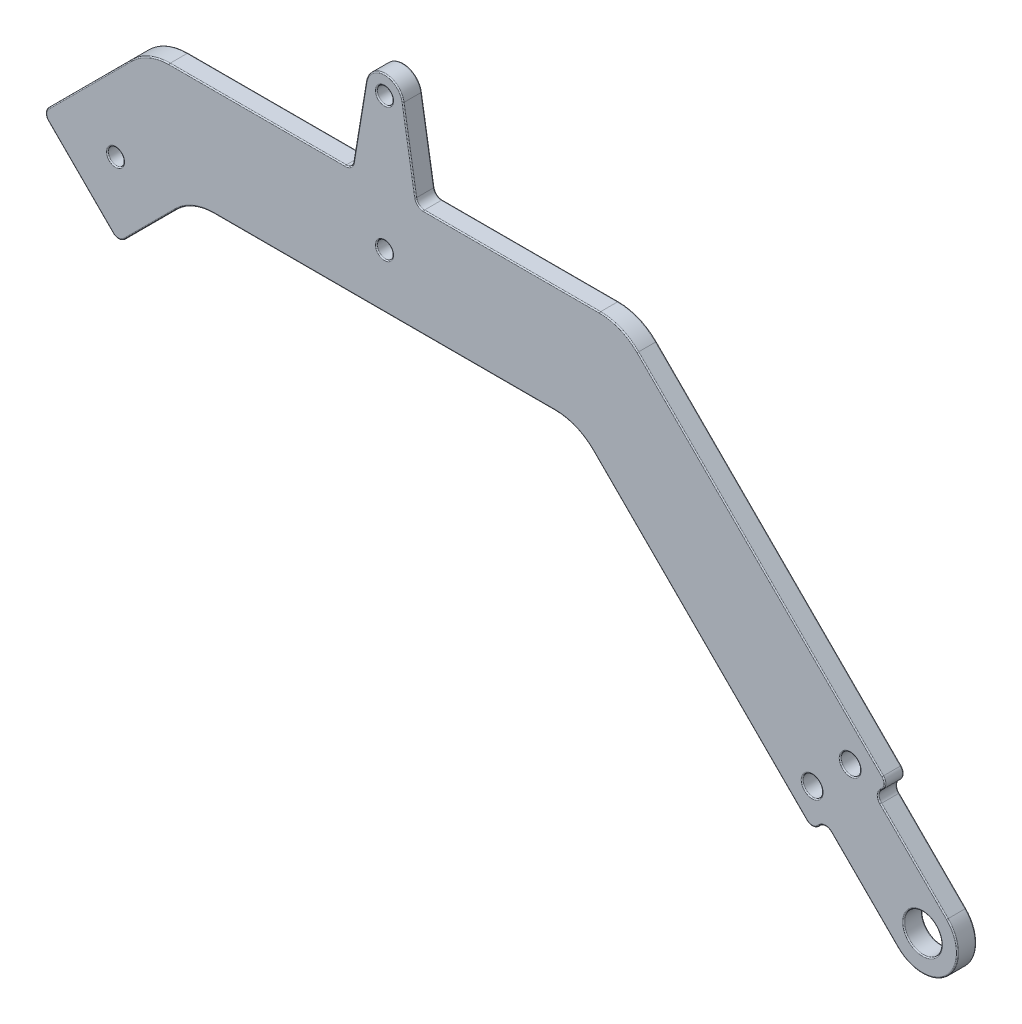
from build123d import *

# Parameters (mm, degrees)
SKETCH6_R           = 3.5
SKETCH6_R_2         = 1.842826212
SKETCH6_R_3         = 1.5
BOSS_EXTRUDE1_DEPTH = 3.5
FILLET1_R           = 10
FILLET2_R           = 1.5
FILLET3_R           = 0.2


with BuildPart() as part:
    # Sketch6 → Boss-Extrude1 (new body)
    # profile 1 of 3: a face of its own
    with BuildSketch(Plane.XY):
        with BuildLine():
            Line((91.161165235, 18.03122292), (81.96877708, 8.838834765))
            Line((81.96877708, 8.838834765), (95.403805922, -4.596194078))
            ThreePointArc((95.403805922, -4.596194078), (104.596194078, -4.596194078), (104.596194078, 4.596194078))
            Line((104.596194078, 4.596194078), (91.161165235, 18.03122292))
        make_face()
        with Locations((100, 0)):
            Circle(SKETCH6_R, mode=Mode.SUBTRACT)
    # profile 2 of 3: a face of its own
    with BuildSketch(Plane.XY):
        Polygon((79.493903346, 6.363961031), (81.96877708, 8.838834765), (91.161165235, 18.03122292), (93.636038969, 20.506096654), (44.142135624, 70), (6, 70), (-6, 70), (-44.142135624, 70), (-63.587572106, 50.554563517), (-49.445436483, 36.412427894), (-35.857864376, 50), (35.857864376, 50), align=None)
        with Locations((79.493903346, 13.435028843)):
            Circle(SKETCH6_R_2, mode=Mode.SUBTRACT)
        with Locations((86.564971157, 20.506096654)):
            Circle(SKETCH6_R_2, mode=Mode.SUBTRACT)
        with Locations((-50, 50)):
            Circle(SKETCH6_R_3, mode=Mode.SUBTRACT)
        with Locations((0, 60)):
            Circle(SKETCH6_R_3, mode=Mode.SUBTRACT)
    # profile 3 of 3: a face of its own
    with BuildSketch(Plane.XY):
        with BuildLine():
            Line((-6, 70), (6, 70))
            Line((6, 70), (3.453220204, 85.420324662))
            ThreePointArc((3.453220204, 85.420324662), (0, 88.35), (-3.453220204, 85.420324662))
            Line((-3.453220204, 85.420324662), (-6, 70))
        make_face()
        with Locations((0, 84.85)):
            Circle(SKETCH6_R_3, mode=Mode.SUBTRACT)
    extrude(amount=BOSS_EXTRUDE1_DEPTH)

    # Fillet1
    fillet1_edges = [part.edges().sort_by_distance(p)[0] for p in [
        (44.142135624, 70, 1.75),
        (35.857864376, 50, 1.75),
        (-35.857864376, 50, 1.75),
        (-44.142135624, 70, 1.75),
    ]]
    fillet(fillet1_edges, radius=FILLET1_R)

    # Fillet2
    fillet2_edges = [part.edges().sort_by_distance(p)[0] for p in [
        (6, 70, 1.75),
        (93.636038969, 20.506096654, 1.75),
        (91.161165235, 18.03122292, 1.75),
        (81.96877708, 8.838834765, 1.75),
        (79.493903346, 6.363961031, 1.75),
        (-49.445436483, 36.412427894, 1.75),
        (-63.587572106, 50.554563517, 1.75),
        (-6, 70, 1.75),
    ]]
    fillet(fillet2_edges, radius=FILLET2_R)

    # Fillet3
    fillet3_edges = [part.edges().sort_by_distance(p)[0] for p in [
        (-56.516504294, 43.483495706, 0),
        (93.014718626, 20.506096654, 0),
        (79.493903346, 6.985281374, 0),
        (-62.966251763, 50.554563517, 0),
        (-49.445436483, 37.033748237, 0),
        (-56.516504294, 43.483495706, 3.5),
        (-23.636292033, 70, 3.5),
        (80.731340213, 7.601397898, 3.5),
        (89.216621587, 1.590990258, 3.5),
        (98.409009742, 10.783378413, 3.5),
        (92.398602102, 19.268659787, 3.5),
        (69.823223305, 44.318912319, 3.5),
        (4.622926377, 78.337949903, 3.5),
        (-4.622926377, 78.337949903, 3.5),
        (93.014718626, 20.506096654, 3.5),
        (79.493903346, 6.985281374, 3.5),
        (-62.966251763, 50.554563517, 3.5),
        (-49.445436483, 37.033748237, 3.5),
        (-6.302181387, 70.356182427, 0),
        (96.5, 0, 3.5),
        (-6.302181387, 70.356182427, 3.5),
        (6.302181387, 70.356182427, 0),
        (6.302181387, 70.356182427, 3.5),
        (81.96877708, 8.217514421, 0),
        (81.96877708, 8.217514421, 3.5),
        (91.782485579, 18.03122292, 0),
        (91.782485579, 18.03122292, 3.5),
        (-1.5, 84.85, 3.5),
        (-1.5, 60, 3.5),
        (84.722144945, 20.506096654, 3.5),
        (104.596194078, -4.596194078, 0),
        (77.651077133, 13.435028843, 3.5),
        (0, 88.35, 0),
        (-51.5, 50, 0),
        (77.651077133, 13.435028843, 0),
        (84.722144945, 20.506096654, 0),
        (-1.5, 60, 0),
        (-1.5, 84.85, 0),
        (96.5, 0, 0),
        (-51.5, 50, 3.5),
        (0, 88.35, 3.5),
        (0, 50, 0),
        (0, 50, 3.5),
        (58.610019869, 27.247844507, 0),
        (58.610019869, 27.247844507, 3.5),
        (-54.798989873, 59.343145751, 0),
        (-54.798989873, 59.343145751, 3.5),
        (23.636292033, 70, 0),
        (43.826834324, 69.238795325, 0),
        (-43.826834324, 69.238795325, 0),
        (23.636292033, 70, 3.5),
        (43.826834324, 69.238795325, 3.5),
        (-43.826834324, 69.238795325, 3.5),
        (-35.542563076, 49.238795325, 0),
        (-35.542563076, 49.238795325, 3.5),
        (35.542563076, 49.238795325, 0),
        (35.542563076, 49.238795325, 3.5),
        (-43.585786438, 42.272077939, 0),
        (-43.585786438, 42.272077939, 3.5),
        (104.596194078, -4.596194078, 3.5),
        (-23.636292033, 70, 0),
        (-4.622926377, 78.337949903, 0),
        (4.622926377, 78.337949903, 0),
        (69.823223305, 44.318912319, 0),
        (92.398602102, 19.268659787, 0),
        (98.409009742, 10.783378413, 0),
        (89.216621587, 1.590990258, 0),
        (80.731340213, 7.601397898, 0),
    ]]
    fillet(fillet3_edges, radius=FILLET3_R)


solid = part.part
